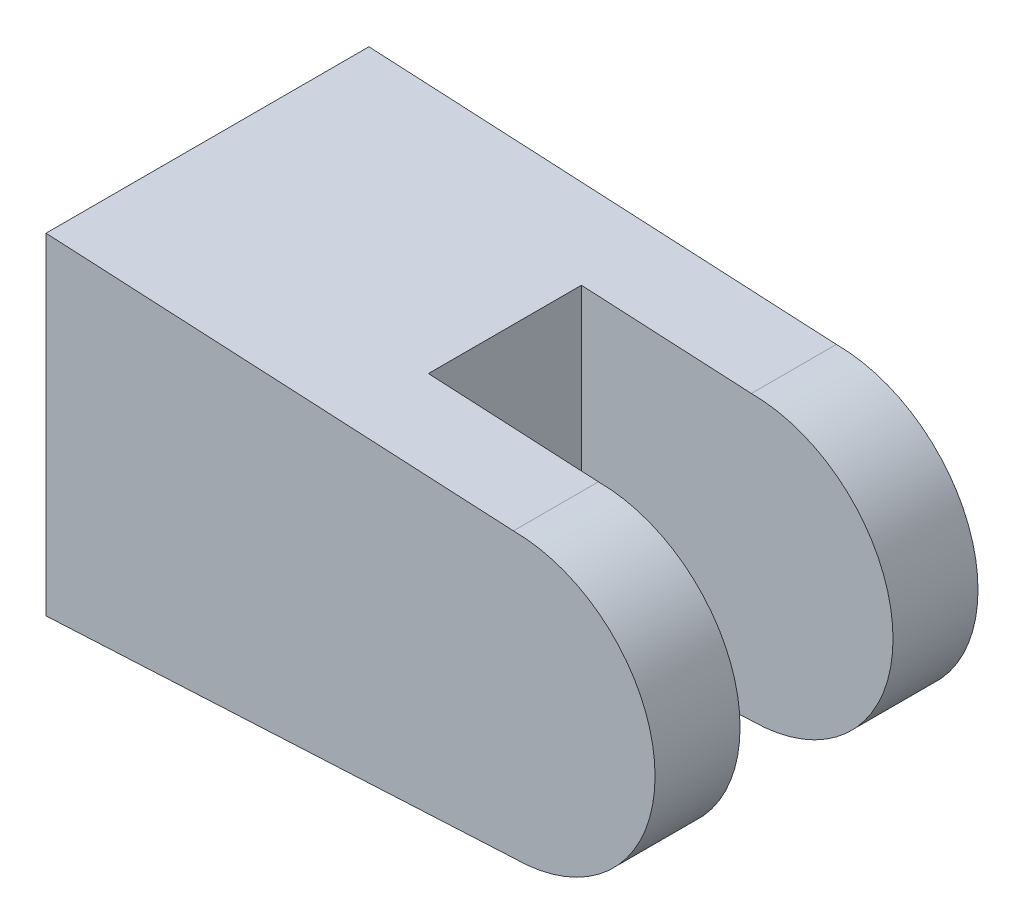
from build123d import *

# Parameters (mm, degrees)
BOSS_EXTRUDE1_DEPTH     = 57
SKETCH2_R               = 37.5
BOSS_EXTRUDE2_DEPTH     = 2
CUT_EXTRUDE2_DEPTH      = 186.90387301
CUT_EXTRUDE2_DEPTH_BACK = 186.90387301
SKETCH3_W               = 110
SKETCH3_H               = 54


with BuildPart() as part:
    # Sketch1 → Boss-Extrude1 (new, symmetric)
    with BuildSketch(Plane.XY):
        with BuildLine():
            Line((0, 50), (-165, 58.5))
            Line((-165, 58.5), (-165, -58.5))
            Line((-165, -58.5), (0, -50))
            ThreePointArc((0, -50), (50, 0), (0, 50))
        make_face()
    extrude(amount=BOSS_EXTRUDE1_DEPTH, both=True)

    # Sketch2 → Boss-Extrude2 (add)
    with BuildSketch(Plane.ZY.offset(165)):
        Circle(SKETCH2_R)
    extrude(amount=BOSS_EXTRUDE2_DEPTH)

    # Sketch3 → Cut-Extrude2 (cut, two sides: drawn at the far end of the back side and taken through both)
    with BuildSketch(Plane(origin=(0, 0, 0), x_dir=(1, 0, 0), z_dir=(0, 1, 0)).offset(-CUT_EXTRUDE2_DEPTH_BACK)):
        with Locations((-5, 0)):
            Rectangle(SKETCH3_W, SKETCH3_H)
    extrude(amount=CUT_EXTRUDE2_DEPTH + CUT_EXTRUDE2_DEPTH_BACK, mode=Mode.SUBTRACT)


solid = part.part
